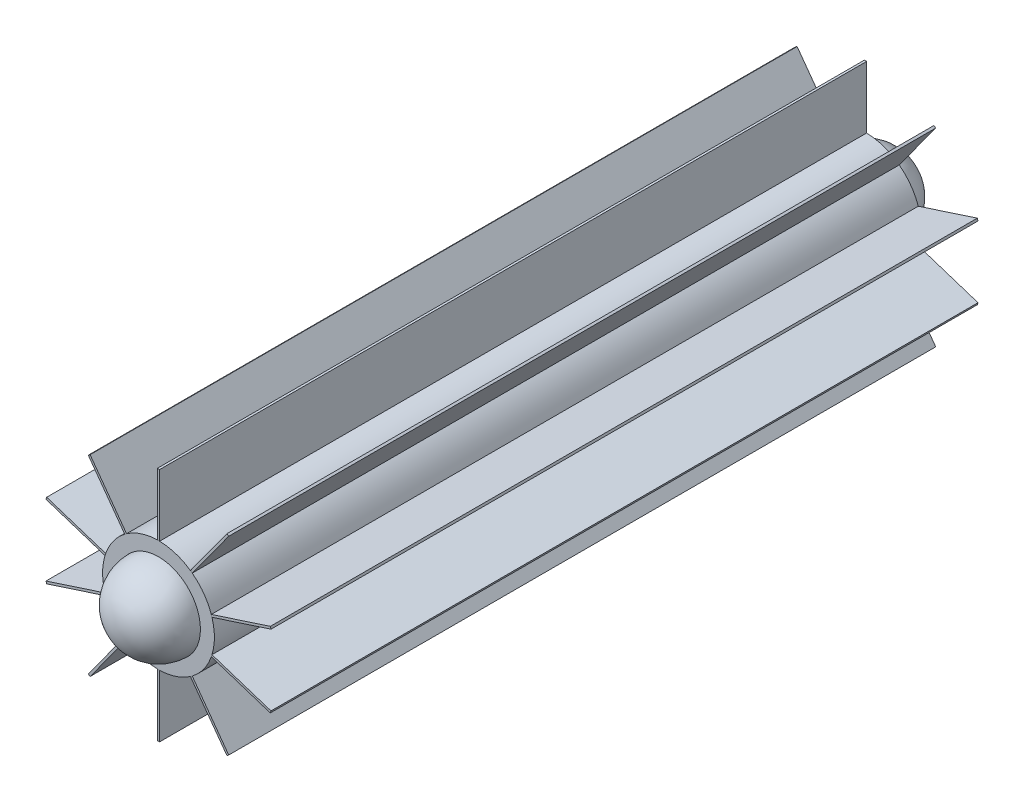
from build123d import *

# Parameters (mm, degrees)
BOSS_EXTRUDE1_DEPTH    = 1265
BOSS_EXTRUDE1_2_DEPTH  = 1265
BOSS_EXTRUDE1_3_DEPTH  = 1265
BOSS_EXTRUDE1_4_DEPTH  = 1265
BOSS_EXTRUDE1_5_DEPTH  = 1265
BOSS_EXTRUDE1_6_DEPTH  = 1265
BOSS_EXTRUDE1_7_DEPTH  = 1265
BOSS_EXTRUDE1_8_DEPTH  = 1265
BOSS_EXTRUDE1_9_DEPTH  = 1265
BOSS_EXTRUDE1_10_DEPTH = 1265
BOSS_EXTRUDE1_11_DEPTH = 1265


with BuildPart() as part:
    # Sketch1 → Boss-Extrude1 (new body)
    with BuildSketch(Plane.XY):
        with BuildLine():
            ThreePointArc((-2, 99.979998), (0, 100), (2, 99.979998))
            Line((2, 99.979998), (2, 210.990521114))
            Line((2, 210.990521114), (-2, 210.990521114))
            Line((-2, 210.990521114), (-2, 99.979998))
        make_face()
    extrude(amount=BOSS_EXTRUDE1_DEPTH)


with BuildPart() as body_2:
    # Sketch1 → Boss-Extrude1 2 (new body)
    with BuildSketch(Plane.XY):
        with BuildLine():
            ThreePointArc((-60.384802337, 79.709946975), (-58.778525229, 80.901699437), (-57.14873436, 82.061087984))
            Line((-57.14873436, 82.061087984), (-122.399082696, 171.870487738))
            Line((-122.399082696, 171.870487738), (-125.635150673, 169.519346729))
            Line((-125.635150673, 169.519346729), (-60.384802337, 79.709946975))
        make_face()
    extrude(amount=BOSS_EXTRUDE1_2_DEPTH)


with BuildPart() as body_3:
    # Sketch1 → Boss-Extrude1 3 (new body)
    with BuildSketch(Plane.XY):
        with BuildLine():
            ThreePointArc((-95.704662585, 28.993405447), (-95.10565163, 30.901699437), (-94.468594608, 32.797631512))
            Line((-94.468594608, 32.797631512), (-200.045875993, 67.101769709))
            Line((-200.045875993, 67.101769709), (-201.281943971, 63.297543644))
            Line((-201.281943971, 63.297543644), (-95.704662585, 28.993405447))
        make_face()
    extrude(amount=BOSS_EXTRUDE1_3_DEPTH)


with BuildPart() as body_4:
    # Sketch1 → Boss-Extrude1 4 (new body)
    with BuildSketch(Plane.XY):
        with BuildLine():
            Line((122.399082696, 171.870487738), (57.14873436, 82.061087984))
            ThreePointArc((57.14873436, 82.061087984), (58.778525229, 80.901699437), (60.384802337, 79.709946975))
            Line((60.384802337, 79.709946975), (125.635150673, 169.519346729))
            Line((125.635150673, 169.519346729), (122.399082696, 171.870487738))
        make_face()
    extrude(amount=BOSS_EXTRUDE1_4_DEPTH)


with BuildPart() as body_5:
    # Sketch1 → Boss-Extrude1 5 (new body)
    with BuildSketch(Plane.XY):
        with BuildLine():
            Line((200.045875993, 67.101769709), (94.468594608, 32.797631512))
            ThreePointArc((94.468594608, 32.797631512), (95.10565163, 30.901699437), (95.704662585, 28.993405447))
            Line((95.704662585, 28.993405447), (201.281943971, 63.297543644))
            Line((201.281943971, 63.297543644), (200.045875993, 67.101769709))
        make_face()
    extrude(amount=BOSS_EXTRUDE1_5_DEPTH)


with BuildPart() as body_6:
    # Sketch1 → Boss-Extrude1 6 (new body)
    with BuildSketch(Plane.XY):
        with BuildLine():
            Line((201.281943971, -63.297543644), (95.704662585, -28.993405447))
            ThreePointArc((95.704662585, -28.993405447), (95.10565163, -30.901699437), (94.468594608, -32.797631512))
            Line((94.468594608, -32.797631512), (200.045875993, -67.101769709))
            Line((200.045875993, -67.101769709), (201.281943971, -63.297543644))
        make_face()
    extrude(amount=BOSS_EXTRUDE1_6_DEPTH)


with BuildPart() as body_7:
    # Sketch1 → Boss-Extrude1 7 (new body)
    with BuildSketch(Plane.XY):
        with BuildLine():
            Line((125.635150673, -169.519346729), (60.384802337, -79.709946975))
            ThreePointArc((60.384802337, -79.709946975), (58.778525229, -80.901699437), (57.14873436, -82.061087984))
            Line((57.14873436, -82.061087984), (122.399082696, -171.870487738))
            Line((122.399082696, -171.870487738), (125.635150673, -169.519346729))
        make_face()
    extrude(amount=BOSS_EXTRUDE1_7_DEPTH)


with BuildPart() as body_8:
    # Sketch1 → Boss-Extrude1 8 (new body)
    with BuildSketch(Plane.XY):
        with BuildLine():
            Line((2, -210.990521114), (2, -99.979998))
            ThreePointArc((2, -99.979998), (0, -100), (-2, -99.979998))
            Line((-2, -99.979998), (-2, -210.990521114))
            Line((-2, -210.990521114), (2, -210.990521114))
        make_face()
    extrude(amount=BOSS_EXTRUDE1_8_DEPTH)


with BuildPart() as body_9:
    # Sketch1 → Boss-Extrude1 9 (new body)
    with BuildSketch(Plane.XY):
        with BuildLine():
            ThreePointArc((-57.14873436, -82.061087984), (-58.778525229, -80.901699437), (-60.384802337, -79.709946975))
            Line((-60.384802337, -79.709946975), (-125.635150673, -169.519346729))
            Line((-125.635150673, -169.519346729), (-122.399082696, -171.870487738))
            Line((-122.399082696, -171.870487738), (-57.14873436, -82.061087984))
        make_face()
    extrude(amount=BOSS_EXTRUDE1_9_DEPTH)


with BuildPart() as body_10:
    # Sketch1 → Boss-Extrude1 10 (new body)
    with BuildSketch(Plane.XY):
        with BuildLine():
            ThreePointArc((-94.468594608, -32.797631512), (-95.10565163, -30.901699437), (-95.704662585, -28.993405447))
            Line((-95.704662585, -28.993405447), (-201.281943971, -63.297543644))
            Line((-201.281943971, -63.297543644), (-200.045875993, -67.101769709))
            Line((-200.045875993, -67.101769709), (-94.468594608, -32.797631512))
        make_face()
    extrude(amount=BOSS_EXTRUDE1_10_DEPTH)


with BuildPart() as body_11:
    # Sketch1 → Boss-Extrude1 11 (new body)
    with BuildSketch(Plane.XY):
        with BuildLine():
            Line((60.384802337, 79.709946975), (57.14873436, 82.061087984))
            ThreePointArc((57.14873436, 82.061087984), (30.901699437, 95.10565163), (2, 99.979998))
            Line((2, 99.979998), (-2, 99.979998))
            ThreePointArc((-2, 99.979998), (-30.901699437, 95.10565163), (-57.14873436, 82.061087984))
            Line((-57.14873436, 82.061087984), (-60.384802337, 79.709946975))
            ThreePointArc((-60.384802337, 79.709946975), (-80.901699437, 58.778525229), (-94.468594608, 32.797631512))
            Line((-94.468594608, 32.797631512), (-95.704662585, 28.993405447))
            ThreePointArc((-95.704662585, 28.993405447), (-100, 0), (-95.704662585, -28.993405447))
            Line((-95.704662585, -28.993405447), (-94.468594608, -32.797631512))
            ThreePointArc((-94.468594608, -32.797631512), (-80.901699437, -58.778525229), (-60.384802337, -79.709946975))
            Line((-60.384802337, -79.709946975), (-57.14873436, -82.061087984))
            ThreePointArc((-57.14873436, -82.061087984), (-30.901699437, -95.10565163), (-2, -99.979998))
            Line((-2, -99.979998), (2, -99.979998))
            ThreePointArc((2, -99.979998), (30.901699437, -95.10565163), (57.14873436, -82.061087984))
            Line((57.14873436, -82.061087984), (60.384802337, -79.709946975))
            ThreePointArc((60.384802337, -79.709946975), (80.901699437, -58.778525229), (94.468594608, -32.797631512))
            Line((94.468594608, -32.797631512), (95.704662585, -28.993405447))
            ThreePointArc((95.704662585, -28.993405447), (98.920337289, -14.6549265), (100, 0))
            ThreePointArc((100, 0), (98.920337289, 14.6549265), (95.704662585, 28.993405447))
            Line((95.704662585, 28.993405447), (94.468594608, 32.797631512))
            ThreePointArc((94.468594608, 32.797631512), (80.901699437, 58.778525229), (60.384802337, 79.709946975))
        make_face()
    extrude(amount=BOSS_EXTRUDE1_11_DEPTH)


with BuildPart() as body_12:
    # Sketch2 → Revolve-Thin1 (revolve)
    with BuildSketch(Plane(origin=(0, 0, 0), x_dir=(1, 0, 0), z_dir=(0, 1, 0))):
        with BuildLine():
            ThreePointArc((65, 0), (45.961940777, 45.961940777), (0, 65))
            Line((0, 65), (0, 75))
            ThreePointArc((0, 75), (53.033008589, 53.033008589), (75, 0))
            Line((75, 0), (65, 0))
        make_face()
    revolve(axis=Axis((0, 0, 0), (0, 0, -1)))


with BuildPart() as body_13:
    # Mirror2: mirrored copy
    add(body_12.part.mirror(Plane(origin=(0, 0, 632.5), x_dir=(1, 0, 0), z_dir=(0, 0, -1))))


solid = Compound([part.part, body_2.part, body_3.part, body_4.part, body_5.part, body_6.part, body_7.part, body_8.part, body_9.part, body_10.part, body_11.part, body_12.part, body_13.part])
